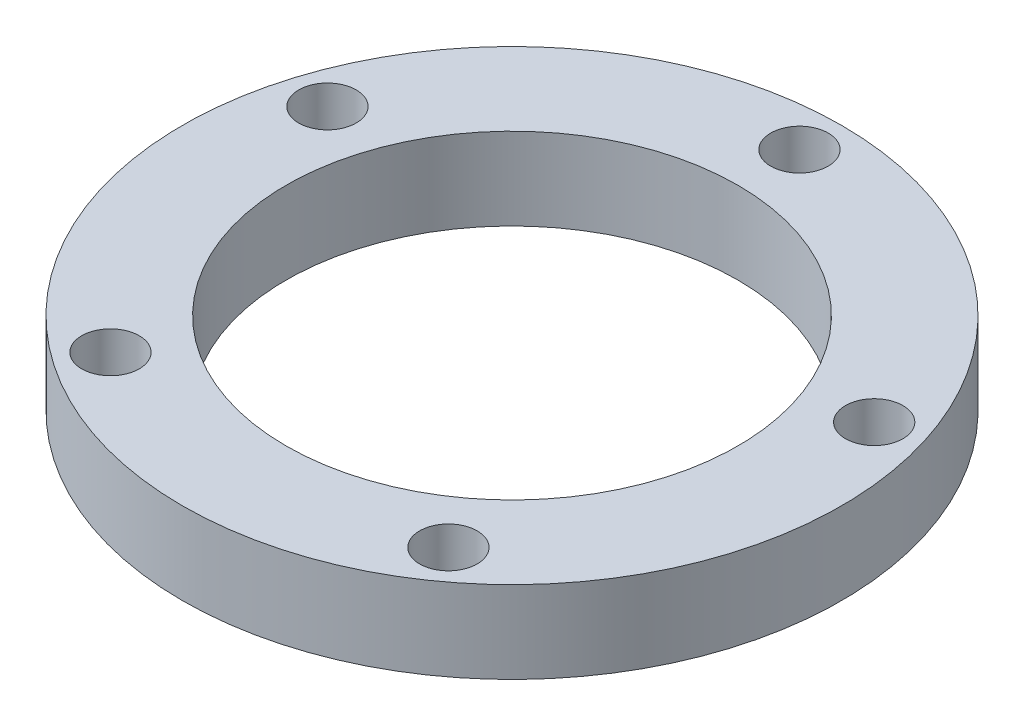
from build123d import *

# Parameters (mm, degrees)
SKETCH1_R           = 40.125
BOSS_EXTRUDE1_DEPTH = 10
SKETCH2_R           = 27.5
CUT_EXTRUDE1_DEPTH  = 10
SKETCH3_R           = 3.5
CUT_EXTRUDE2_DEPTH  = 10


with BuildPart() as part:
    # Sketch1 → Boss-Extrude1 (new body)
    with BuildSketch(Plane(origin=(0, 0, 0), x_dir=(1, 0, 0), z_dir=(0, 1, 0))):
        with Locations(Location((0, 0, 0), (0, 0, 270))):
            Circle(SKETCH1_R)
    extrude(amount=BOSS_EXTRUDE1_DEPTH)

    # Sketch2 → Cut-Extrude1 (cut)
    with BuildSketch(Plane(origin=(0, 10, 0), x_dir=(1, 0, 0), z_dir=(0, 1, 0))):
        with Locations(Location((0, 0, 0), (0, 0, 270))):
            Circle(SKETCH2_R)
    extrude(amount=-CUT_EXTRUDE1_DEPTH, mode=Mode.SUBTRACT)

    # Sketch3 → Cut-Extrude2 (cut)
    with BuildSketch(Plane(origin=(0, 10, 0), x_dir=(1, 0, 0), z_dir=(0, 1, 0))):
        with Locations(Location((0, 35, 0), (0, 0, 270))):
            Circle(SKETCH3_R)
        with Locations(Location((33.28697807, 10.815594803, 0), (0, 0, 270))):
            Circle(SKETCH3_R)
        with Locations(Location((20.57248383, -28.315594803, 0), (0, 0, 270))):
            Circle(SKETCH3_R)
        with Locations(Location((-20.57248383, -28.315594803, 0), (0, 0, 270))):
            Circle(SKETCH3_R)
        with Locations(Location((-33.28697807, 10.815594803, 0), (0, 0, 270))):
            Circle(SKETCH3_R)
    extrude(amount=-CUT_EXTRUDE2_DEPTH, mode=Mode.SUBTRACT)


solid = part.part
